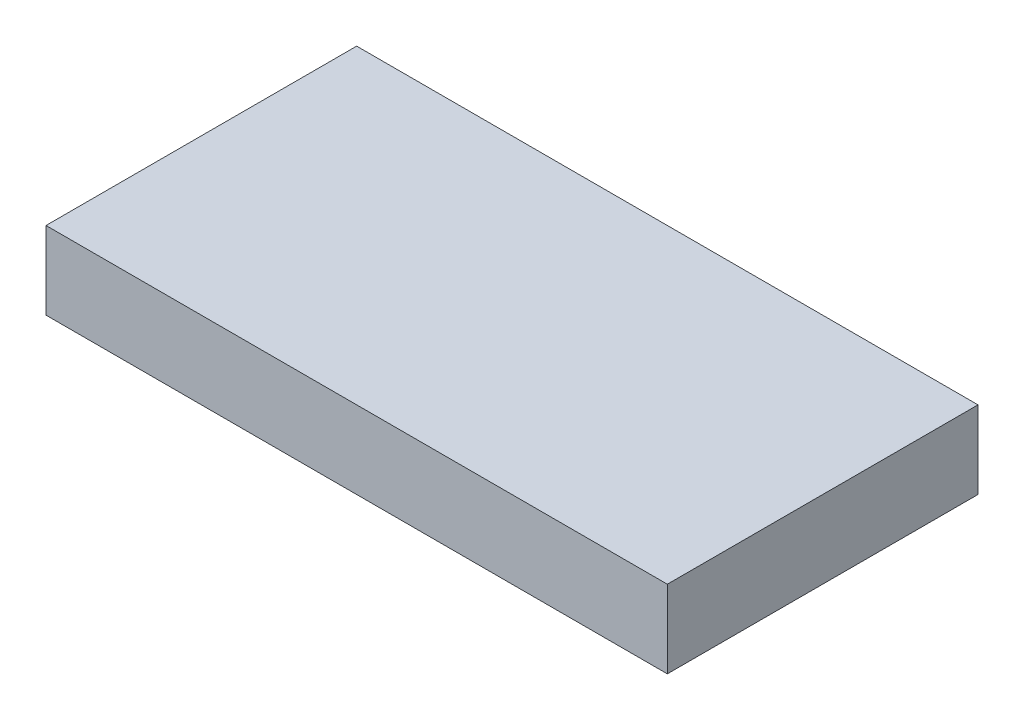
from build123d import *

# Parameters (mm, degrees)
SKETCH1_W           = 40
SKETCH1_H           = 20
BOSS_EXTRUDE1_DEPTH = 5


with BuildPart() as part:
    # Sketch1 → Boss-Extrude1 (new body)
    with BuildSketch(Plane(origin=(0, 0, 0), x_dir=(1, 0, 0), z_dir=(0, 1, 0))):
        Rectangle(SKETCH1_W, SKETCH1_H)
    extrude(amount=BOSS_EXTRUDE1_DEPTH)


solid = part.part
